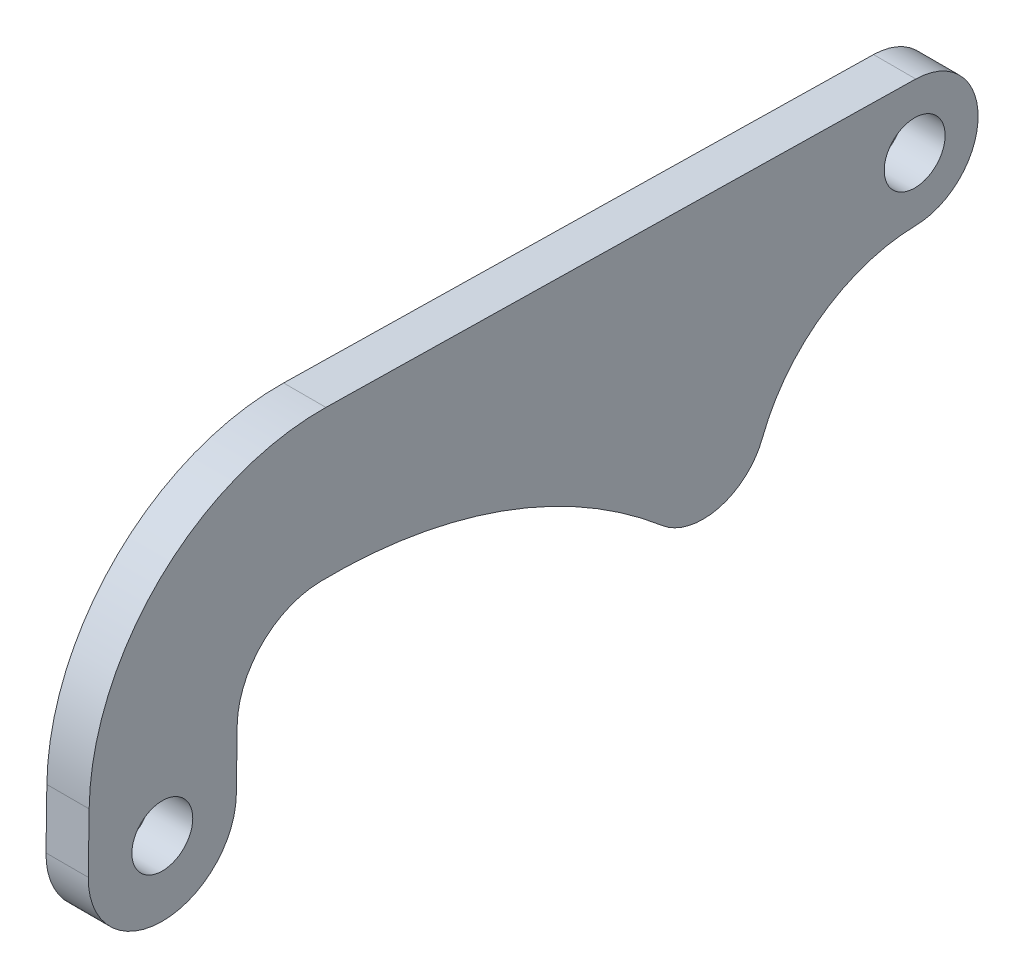
from build123d import *

# Parameters (mm, degrees)
SKETCH1_R           = 2.286
BOSS_EXTRUDE1_DEPTH = 1.5875


with BuildPart() as part:
    # Sketch1 → Boss-Extrude1 (new, symmetric)
    with BuildSketch(Plane(origin=(0, 0, 0), x_dir=(0, 0, -1), z_dir=(1, 0, 0))):
        with BuildLine():
            Line((-5.555690027, 0.078882129), (-5.492947583, 4.497849692))
            ThreePointArc((-5.492947583, 4.497849692), (-0.180708129, 16.793970412), (12.279247772, 21.709656704))
            Line((12.279247772, 21.709656704), (56.556266052, 20.919821075))
            ThreePointArc((56.556266052, 20.919821075), (61.233823705, 16.158078636), (56.556266052, 11.396336198))
            ThreePointArc((56.556266052, 11.396336198), (49.56780942, 9.124706187), (45.041369891, 3.335908885))
            ThreePointArc((45.041369891, 3.335908885), (41.771149469, 0.430257339), (37.509684519, 1.418725347))
            ThreePointArc((37.509684519, 1.418725347), (25.520855431, 8.352797068), (11.854536038, 10.598924348))
            ThreePointArc((11.854536038, 10.598924348), (7.469501812, 8.731884997), (5.61843247, 4.340085435))
            Line((5.61843247, 4.340085435), (5.555690027, -0.078882129))
            ThreePointArc((5.555690027, -0.078882129), (-0.078882129, -5.555690027), (-5.555690027, 0.078882129))
        make_face()
        Circle(SKETCH1_R, mode=Mode.SUBTRACT)
        with Locations((56.471323705, 16.158078636)):
            Circle(SKETCH1_R, mode=Mode.SUBTRACT)
    extrude(amount=BOSS_EXTRUDE1_DEPTH, both=True)


solid = part.part
